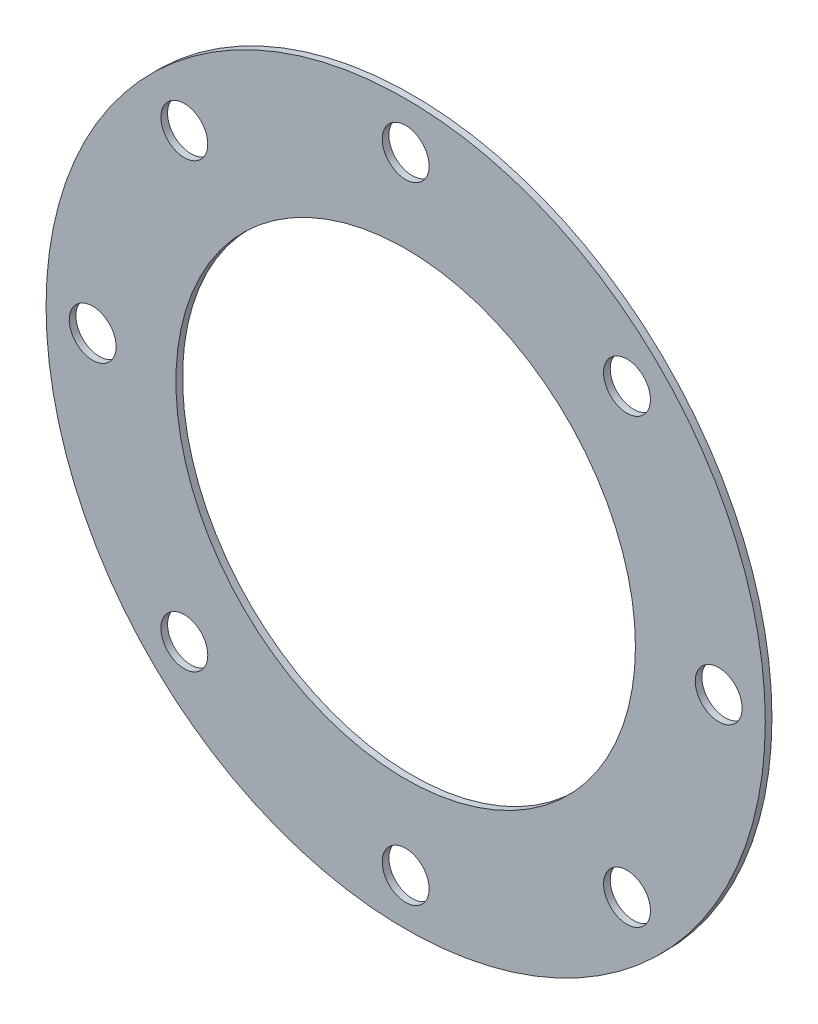
from build123d import *

# Parameters (mm, degrees)
SKETCH1_R           = 171.45
SKETCH1_R_2         = 109.5375
BOSS_EXTRUDE1_DEPTH = 1.5875
SKETCH2_R           = 11.176
CUT_EXTRUDE1_DEPTH  = 243.472112121
CIRPATTERN1_COUNT   = 8


with BuildPart() as part:
    # Sketch1 → Boss-Extrude1 (new, symmetric)
    with BuildSketch(Plane.XY):
        Circle(SKETCH1_R)
        Circle(SKETCH1_R_2, mode=Mode.SUBTRACT)
    extrude(amount=BOSS_EXTRUDE1_DEPTH, both=True)

    # Sketch2 → Cut-Extrude1 (cut, symmetric)
    with BuildSketch(Plane.XY):
        with Locations((0, 149.225)):
            Circle(SKETCH2_R)
    cut_extrude1 = extrude(amount=CUT_EXTRUDE1_DEPTH, both=True, mode=Mode.SUBTRACT)

    # CirPattern1: Cut-Extrude1 ×8 about axis
    cirpattern1_axis = Axis((0, 0, 0), (0, 0, 1))
    for i in range(1, CIRPATTERN1_COUNT):
        add(cut_extrude1.rotate(cirpattern1_axis, i * 360 / CIRPATTERN1_COUNT), mode=Mode.SUBTRACT)


solid = part.part
